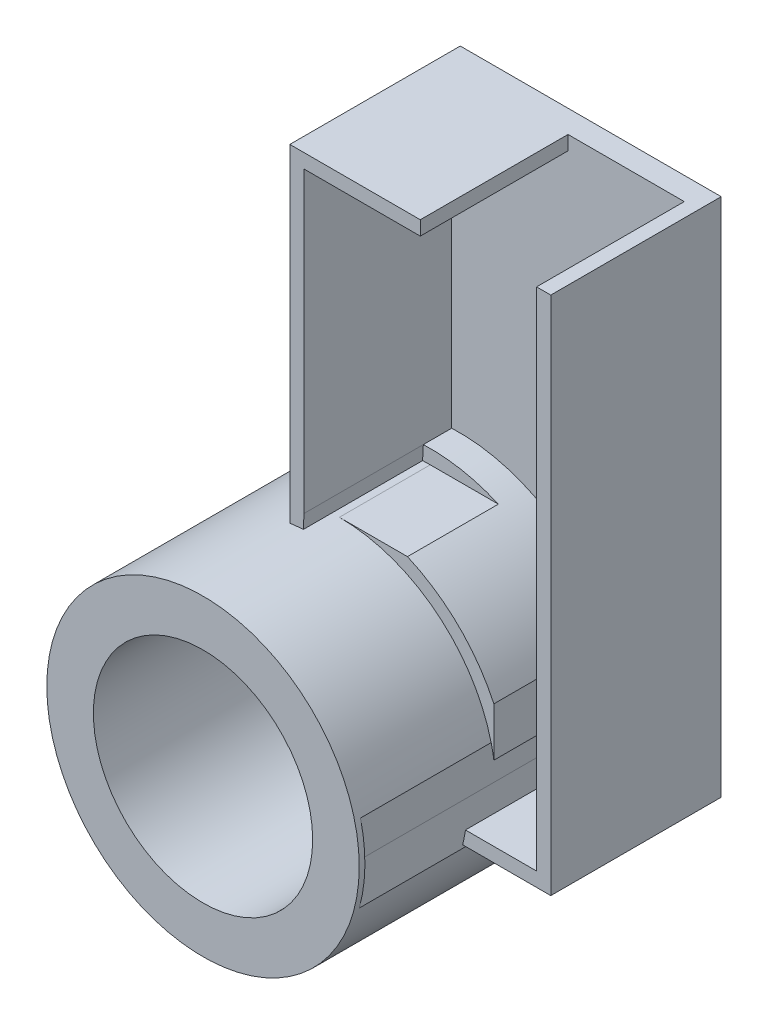
from build123d import *
from build123d.topology import SkipClean

# Parameters (mm, degrees)
BOSS_EXTRUDE1_DEPTH     = 24
CUT_EXTRUDE1_DEPTH      = 91.21363533302491
CUT_EXTRUDE1_DEPTH_BACK = 91.21363533302491
SKETCH2_4_R             = 16.25
CUT_EXTRUDE2_DEPTH      = 3
CUT_EXTRUDE2_DEPTH_BACK = 48
SKETCH2_5_R             = 19.5
SKETCH2_5_R_2           = 16.25
CUT_EXTRUDE3_DEPTH      = 48
CUT_EXTRUDE3_DEPTH_BACK = 16
SKETCH3_W               = 8.5
SKETCH3_H               = 14.200000000000006
CUT_EXTRUDE4_DEPTH      = 40
SKETCH7_R               = 27.499999999999996
SKETCH7_R_2             = 18.9
BOSS_EXTRUDE2_DEPTH     = 1
SKETCH8_W               = 181.3602376825947
SKETCH8_H               = 155.21218123297842
CUT_EXTRUDE5_DEPTH      = 48
BOSS_EXTRUDE3_START     = 48
SKETCH9_R               = 27.499999999999996
SKETCH9_R_2             = 18.9
BOSS_EXTRUDE3_DEPTH     = 48
CUT_EXTRUDE6_DEPTH      = 48
BOSS_EXTRUDE4_DEPTH     = 4
EXTRUDE_THIN2_DEPTH     = 30
CUT_EXTRUDE8_START      = -21
CUT_EXTRUDE8_DEPTH      = 21
BOSS_EXTRUDE5_DEPTH     = 21
CUT_EXTRUDE9_DEPTH      = 21
CUT_EXTRUDE10_DEPTH     = 5
SKETCH21_R              = 27.499999999999996
SKETCH21_R_2            = 7.25
BOSS_EXTRUDE6_DEPTH     = 3
SKETCH24_W              = 354.97877750373505
SKETCH24_H              = 136.88577918663822
CUT_EXTRUDE13_DEPTH     = 109.99999999999999
SKETCH25_R              = 19.3
CUT_EXTRUDE14_DEPTH     = 46


with BuildPart() as part:
    # Sketch2 → Boss-Extrude1 (new, symmetric)
    with BuildSketch(Plane.XY):
        with BuildLine():
            ThreePointArc((-24.69493875270801, -42.900000000000006), (1.68e-15, -82.5), (24.694938752708016, -42.9))
            ThreePointArc((24.694938752708016, -42.9), (21.124860801609124, -27.49999999999999), (24.694938752708012, -12.099999999999996))
            ThreePointArc((24.694938752708012, -12.099999999999996), (3.42e-15, 27.499999999999996), (-24.694938752708012, -12.100000000000001))
            ThreePointArc((-24.694938752708012, -12.100000000000001), (-21.124860801609117, -27.500000000000004), (-24.69493875270801, -42.900000000000006))
        make_face()
    extrude(amount=BOSS_EXTRUDE1_DEPTH, both=True)

    # Sketch2<4> → Cut-Extrude1 (cut, two sides: drawn at the far end of the back side and taken through both)
    with BuildSketch(Plane.XY.offset(-CUT_EXTRUDE1_DEPTH_BACK)):
        with Locations((6.74e-15, -55)):
            Circle(SKETCH2_4_R)
    extrude(amount=CUT_EXTRUDE1_DEPTH + CUT_EXTRUDE1_DEPTH_BACK, mode=Mode.SUBTRACT)

    # Sketch2<5> → Cut-Extrude2 (cut, two sides: drawn at the far end of the back side and taken through both)
    with BuildSketch(Plane.XY.offset(-CUT_EXTRUDE2_DEPTH_BACK)):
        with Locations((6.74e-15, -55)):
            Circle(SKETCH2_5_R)
        with Locations((6.74e-15, -55)):
            Circle(SKETCH2_5_R_2, mode=Mode.SUBTRACT)
    extrude(amount=CUT_EXTRUDE2_DEPTH + CUT_EXTRUDE2_DEPTH_BACK, mode=Mode.SUBTRACT)

    # Sketch2<6> → Cut-Extrude3 (cut, two sides: drawn at the far end of the back side and taken through both)
    with BuildSketch(Plane.XY.offset(-CUT_EXTRUDE3_DEPTH_BACK)):
        Polygon((10.399999999999997, 20.400000000000002), (-10.400000000000002, 20.400000000000002), (-10.399999999999999, -20.399999999999995), (10.400000000000002, -20.399999999999995), align=None)
    extrude(amount=CUT_EXTRUDE3_DEPTH + CUT_EXTRUDE3_DEPTH_BACK, mode=Mode.SUBTRACT)

    # Sketch3 → Cut-Extrude4 (cut)
    with BuildSketch(Plane.XY.offset(24)):
        with Locations((0, 27.500000000000007)):
            Rectangle(SKETCH3_W, SKETCH3_H)
    extrude(amount=-CUT_EXTRUDE4_DEPTH, mode=Mode.SUBTRACT)

    # Sketch7 → Boss-Extrude2 (add)
    with BuildSketch(Plane(origin=(0, 0, -24), x_dir=(-1, 0, 0), z_dir=(0, 0, -1))):
        with Locations((-6.74e-15, -55)):
            Circle(SKETCH7_R)
        with Locations((-6.74e-15, -55)):
            Circle(SKETCH7_R_2, mode=Mode.SUBTRACT)
    extrude(amount=BOSS_EXTRUDE2_DEPTH)

    # Sketch8 → Cut-Extrude5 (cut)
    with BuildSketch(Plane.XY.offset(24)):
        with Locations((-25.06580059332441, -26.494305521168478)):
            Rectangle(SKETCH8_W, SKETCH8_H)
    extrude(amount=-CUT_EXTRUDE5_DEPTH, mode=Mode.SUBTRACT)

    # Sketch9 → Boss-Extrude3 (add)
    with SkipClean():  # the faces are left unmerged after this step: merging them gives an invalid solid
        with BuildSketch(Plane.XY.offset(-24).offset(BOSS_EXTRUDE3_START)):
            with Locations(Location((6.74e-15, -55, 0), (0, 0, 180))):
                Circle(SKETCH9_R)
            with Locations((6.74e-15, -55)):
                Circle(SKETCH9_R_2, mode=Mode.SUBTRACT)
        extrude(amount=-BOSS_EXTRUDE3_DEPTH)

    # Sketch10 → Cut-Extrude6 (cut)
    with SkipClean():  # the faces are left unmerged after this step: merging them gives an invalid solid
        with BuildSketch(Plane.XY.offset(24)):
            with BuildLine():
                Line((26.717930940571712, -48.48830542371335), (26.510281823927063, -55))
                Line((26.510281823927063, -55), (26.510281823927063, -62.311289736835946))
                ThreePointArc((26.51028182392707, -62.311289736835946), (27.25144721072622, -58.68898697761363), (27.500000000000014, -55))
                ThreePointArc((27.500000000000014, -55), (27.30378271289276, -51.72075472598662), (26.717930940571723, -48.48830542371334))
            make_face()
            with BuildLine():
                ThreePointArc((-5.604082705298323, -81.92293180603063), (6e-15, -82.5), (5.604082705298339, -81.92293180603063))
                Line((5.604082705298337, -81.92293180603063), (6.74e-15, -81.92293180603063))
                Line((7.11e-15, -81.92293180603063), (-5.604082705298323, -81.92293180603063))
            make_face()
        extrude(amount=-CUT_EXTRUDE6_DEPTH, mode=Mode.SUBTRACT)

    # Sketch11 → Boss-Extrude4 (add)
    with SkipClean():  # the faces are left unmerged after this step: merging them gives an invalid solid
        with BuildSketch(Plane.XY.offset(24)):
            with BuildLine():
                ThreePointArc((27.500000000000025, -55.00000000000003), (27.300326018506244, -58.3078995273848), (26.7042036884893, -61.56776258429582))
                Line((26.70420368848926, -61.56776258429563), (42.21724684134985, -61.56776258429563))
                Line((42.21724684134985, -61.56776258429563), (42.21724684134985, 29.98869686217629))
                Line((42.21724684134985, 29.988696862176287), (-3.7193423220770256, 29.988696862176287))
                Line((-3.719342322077025, 29.988696862176287), (-3.719342322077025, -27.7526791648939))
                ThreePointArc((-3.719342322077028, -27.7526791648939), (15.483065545848751, -32.27282064789051), (26.717930940571723, -48.488305423713314))
                ThreePointArc((26.717930940571723, -48.488305423713314), (27.303782712892772, -51.72075472598662), (27.500000000000025, -55.00000000000002))
            make_face()
        extrude(amount=-BOSS_EXTRUDE4_DEPTH)

    # Sketch16 → Extrude-Thin2 (add)
    with SkipClean():  # the faces are left unmerged after this step: merging them gives an invalid solid
        with BuildSketch(Plane(origin=(0, 0, 24), x_dir=(-1, 0, 0), z_dir=(0, 0, -1))):
            with BuildLine():
                Line((-26.704203688489347, -61.56776258429563), (-42.21724684134985, -61.56776258429563))
                Line((-42.21724684134985, -61.56776258429563), (-42.21724684134985, 29.988696862176287))
                Line((-42.21724684134985, 29.988696862176287), (3.719342322077025, 29.988696862176287))
                Line((3.719342322077025, 29.988696862176287), (3.719342322077025, -27.75267916489391))
                ThreePointArc((3.719342322077025, -27.75267916489391), (-20.443603637167037, -36.60682000505511), (-26.704203688489347, -61.56776258429563))
            make_face()
            with BuildLine():
                Line((-29.722942444479006, -59.06776258429563), (-39.71724684134985, -59.06776258429563))
                Line((-39.71724684134985, -59.06776258429563), (-39.71724684134985, 27.48869686217629))
                Line((-39.71724684134985, 27.48869686217629), (1.2193423220770256, 27.488696862176287))
                Line((1.2193423220770256, 27.488696862176287), (1.2193423220770252, -25.02479017084956))
                ThreePointArc((1.2193423220770252, -25.02479017084956), (-22.200108055370485, -34.82191281786335), (-29.722942444479006, -59.06776258429563))
            make_face(mode=Mode.SUBTRACT)
        extrude(amount=EXTRUDE_THIN2_DEPTH)

    # Sketch17 → Cut-Extrude8 (cut)
    with BuildSketch(Plane(origin=(0, 0, -5.999999999999998), x_dir=(-1, 0, 0), z_dir=(0, 0, -1)).offset(CUT_EXTRUDE8_START)):
        with BuildLine():
            Line((1.3487027041950868, -27.533092620105528), (1.2193423220770252, -25.02479017084956))
            ThreePointArc((1.2193423220770252, -25.02479017084956), (-22.20010805537015, -34.82191281786366), (-29.72294244447902, -59.06776258429561))
            Line((-29.72294244447902, -59.06776258429561), (-27.19748715520997, -59.06776258429561))
            ThreePointArc((-27.19748715520997, -59.06776258429561), (-20.387465924836167, -36.54461506324914), (1.3487027041950868, -27.533092620105528))
        make_face()
    extrude(amount=CUT_EXTRUDE8_DEPTH, mode=Mode.SUBTRACT)

    # Sketch18 → Boss-Extrude5 (add)
    with BuildSketch(Plane(origin=(0, 0, 20), x_dir=(-1, 0, 0), z_dir=(0, 0, -1))):
        with BuildLine():
            ThreePointArc((-27.19748715520984, -50.93223741570337), (-17.949742740939968, -34.16597169210712), (-1.0275e-13, -27.499999999999904))
            Line((-1.0275e-13, -27.499999999999908), (-11.98957880828152, -27.499999999999908))
            ThreePointArc((-11.98957880828161, -27.49999999999943), (-20.951294804022364, -33.528082385707165), (-27.197487155209934, -42.33916699256241))
            Line((-27.197487155209956, -42.339166992562404), (-27.197487155209956, -50.93223741570336))
        make_face()
    extrude(amount=BOSS_EXTRUDE5_DEPTH)

    # Sketch19 → Cut-Extrude9 (cut)
    with BuildSketch(Plane(origin=(0, 0, -5.999999999999998), x_dir=(-1, 0, 0), z_dir=(0, 0, -1))):
        Polygon((-39.71724684134985, 27.48869686217629), (-39.71724684134984, 29.988696862176287), (-19.248952259636408, 29.988696862176287), (-19.24895225963641, 27.48869686217629), align=None)
    extrude(amount=-CUT_EXTRUDE9_DEPTH, mode=Mode.SUBTRACT)

    # Sketch20 → Cut-Extrude10 (cut)
    with BuildSketch(Plane(origin=(0, 0, 15.000000000000004), x_dir=(-1, 0, 0), z_dir=(0, 0, -1))):
        Polygon((-19.248952259636408, 29.988696862176287), (-39.71724684134984, 29.988696862176287), (-39.71724684134984, 27.48869686217629), (-19.24895225963641, 27.48869686217629), align=None)
    extrude(amount=-CUT_EXTRUDE10_DEPTH, mode=Mode.SUBTRACT)

    # Sketch21 → Boss-Extrude6 (add)
    with BuildSketch(Plane.XY.offset(24)):
        with Locations(Location((6.74e-15, -55, 0), (0, 0, 180))):
            Circle(SKETCH21_R)
        with Locations((6.74e-15, -55)):
            Circle(SKETCH21_R_2, mode=Mode.SUBTRACT)
    extrude(amount=-BOSS_EXTRUDE6_DEPTH)


with BuildPart() as body_2:
    # Mirror1: mirrored copy
    add(part.part.mirror(Plane.XY.offset(34)))

    # Sketch25 → Cut-Extrude14 (cut)
    with BuildSketch(Plane.XY.offset(93)):
        with Locations((6.74e-15, -55)):
            Circle(SKETCH25_R)
    extrude(amount=-CUT_EXTRUDE14_DEPTH, mode=Mode.SUBTRACT)


with BuildPart() as part_1:
    add(part.part)

    # Sketch24 → Cut-Extrude13 (cut)
    with BuildSketch(Plane.XY.offset(24)):
        with Locations((-135.2721419105177, -38.45419273114281)):
            Rectangle(SKETCH24_W, SKETCH24_H)
    extrude(amount=-CUT_EXTRUDE13_DEPTH, mode=Mode.SUBTRACT)


solid = body_2.part
